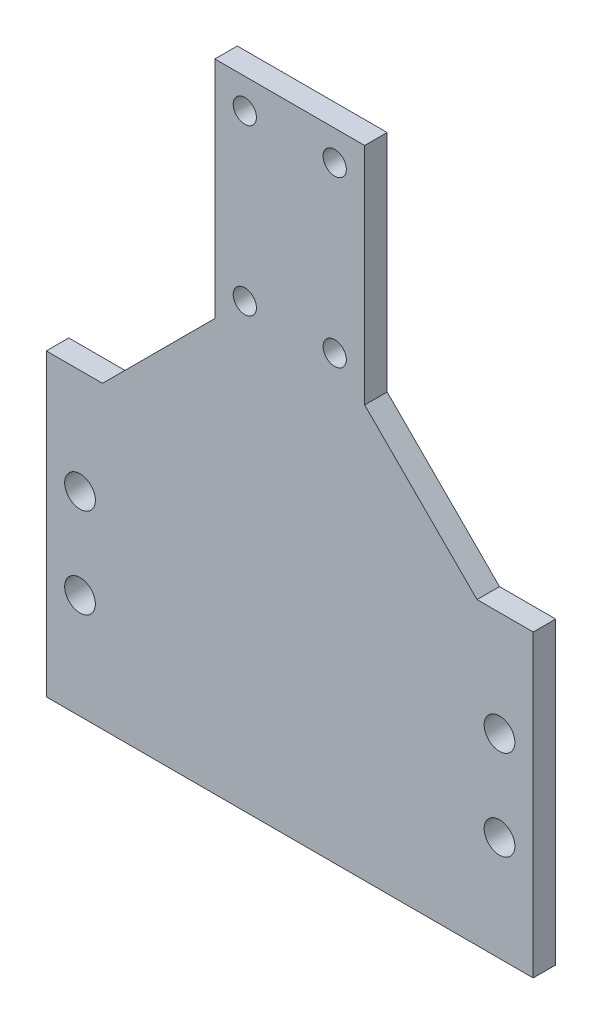
from build123d import *

# Parameters (mm, degrees)
EXTRUDE_1_DEPTH     = 3
SKETCH_2_R          = 1.55
CUT_EXTRUDE_1_DEPTH = 92.050809991
SKETCH_3_R          = 2.05
CUT_EXTRUDE_2_DEPTH = 92.050809991


with BuildPart() as part:
    # 草图1 → 凸台-拉伸1 (new body)
    with BuildSketch(Plane.XY):
        Polygon((-32.5, 40), (-25, 40), (-10, 55), (-10, 85), (10, 85), (10, 55), (25, 40), (32.5, 40), (32.5, 0), (-32.5, 0), align=None)
    extrude(amount=EXTRUDE_1_DEPTH)

    # 草图2 → 切除-拉伸1 (cut, through all)
    with BuildSketch(Plane.XY.offset(3)):
        with Locations((-6, 81)):
            Circle(SKETCH_2_R)
        with Locations(Location((-6, 59, 0), (0, 0, 180))):
            Circle(SKETCH_2_R)
        with Locations((6, 59)):
            Circle(SKETCH_2_R)
        with Locations(Location((6, 81, 0), (0, 0, 180))):
            Circle(SKETCH_2_R)
    extrude(amount=-CUT_EXTRUDE_1_DEPTH, mode=Mode.SUBTRACT)

    # 草图3 → 切除-拉伸2 (cut, through all)
    with BuildSketch(Plane.XY.offset(3)):
        with Locations((-28, 26)):
            Circle(SKETCH_3_R)
        with Locations(Location((-28, 14, 0), (0, 0, 180))):
            Circle(SKETCH_3_R)
        with Locations((28, 14)):
            Circle(SKETCH_3_R)
        with Locations(Location((28, 26, 0), (0, 0, 180))):
            Circle(SKETCH_3_R)
    extrude(amount=-CUT_EXTRUDE_2_DEPTH, mode=Mode.SUBTRACT)


solid = part.part
